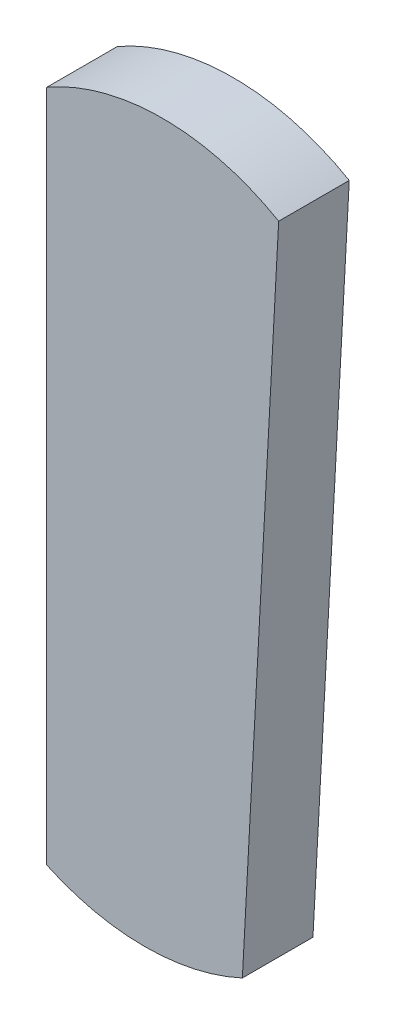
from build123d import *

# Parameters (mm, degrees)
BOSS_EXTRUDE1_DEPTH = 7


with BuildPart() as part:
    # Sketch1 → Boss-Extrude1 (new body)
    with BuildSketch(Plane.XY):
        with BuildLine():
            ThreePointArc((0, 35.9), (11.5, 38.981415713), (23, 35.9))
            Line((23, 35.9), (0, 35.9))
        make_face()
        Polygon((23, 35.9), (19.4, -30.9), (0, -30.9), (0, 35.9), align=None)
        with BuildLine():
            ThreePointArc((19.4, -30.9), (9.7, -33.045504082), (0, -30.9))
            Line((0, -30.9), (19.4, -30.9))
        make_face()
    extrude(amount=BOSS_EXTRUDE1_DEPTH)


solid = part.part
